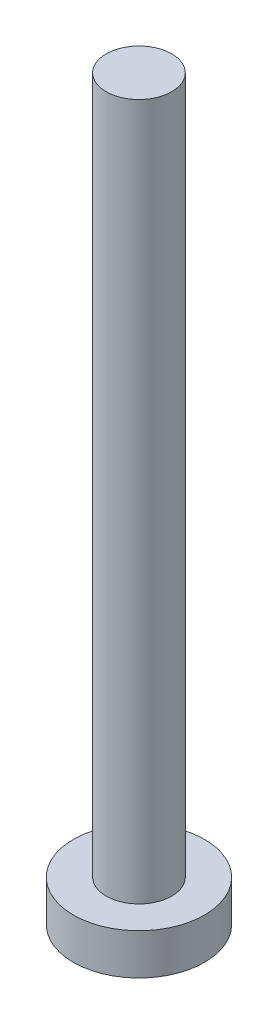
from build123d import *

# Parameters (mm, degrees)
CUT_EXTRUDE1_DEPTH = 2


with BuildPart() as part:
    # Sketch1 → Revolve1 (revolve)
    with BuildSketch(Plane(origin=(0, 0, 0), x_dir=(0, 0, -1), z_dir=(1, 0, 0))):
        Polygon((-4, 42.5), (-4, -42.5), (-8, -42.5), (-8, -47.5), (0, -47.5), (0, 42.5), align=None)
    revolve(axis=Axis((0, 13.745646521, 0), (0, -1, 0)))

    # Sketch5 → Cut-Extrude1 (cut)
    with BuildSketch(Plane.XZ.offset(47.5)):
        Polygon((-1, 5), (1, 5), (1, 1), (5, 1), (5, -1), (1, -1), (1, -5), (-1, -5), (-1, -1), (-5, -1), (-5, 1), (-1, 1), align=None)
    extrude(amount=-CUT_EXTRUDE1_DEPTH, mode=Mode.SUBTRACT)


solid = part.part
